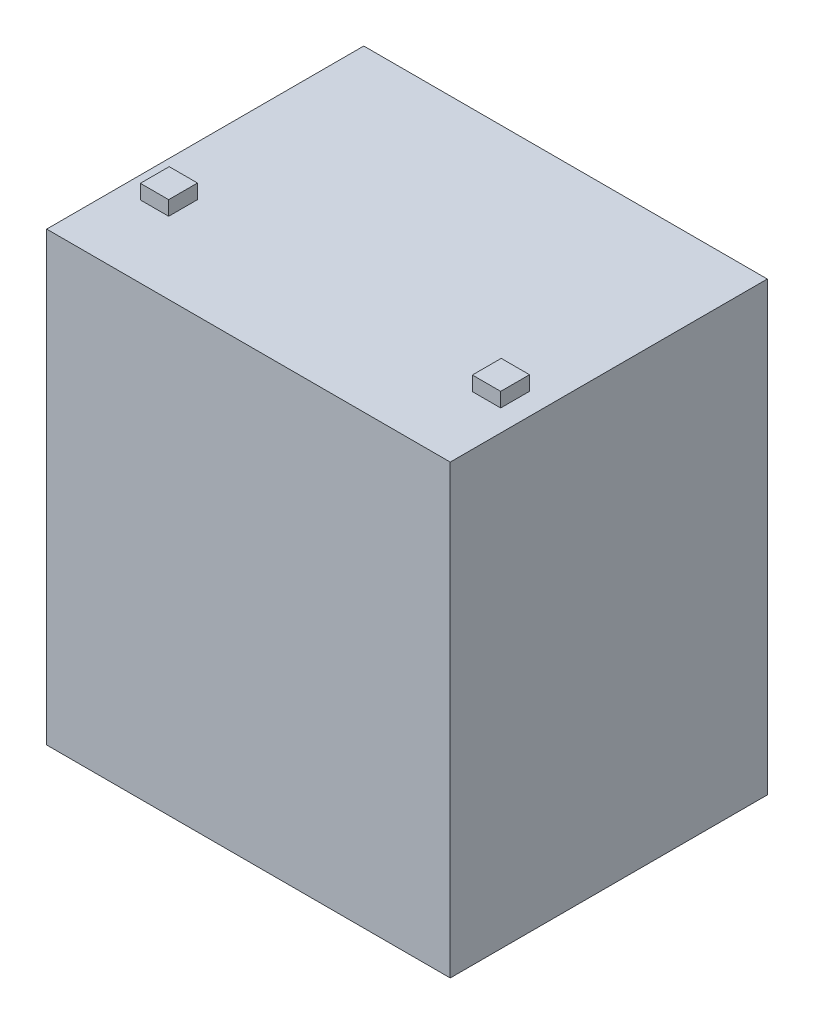
from build123d import *

# Parameters (mm, degrees)
SKETCH2_W           = 88.9
SKETCH2_H           = 98.425
BOSS_EXTRUDE1_DEPTH = 69.85
SKETCH3_W           = 6.235827492
SKETCH3_H           = 6.35
BOSS_EXTRUDE2_DEPTH = 3.175


with BuildPart() as part:
    # Sketch2 → Boss-Extrude1 (new body)
    with BuildSketch(Plane.XY):
        Rectangle(SKETCH2_W, SKETCH2_H)
    extrude(amount=-BOSS_EXTRUDE1_DEPTH)

    # Sketch3 → Boss-Extrude2 (add)
    with BuildSketch(Plane(origin=(0, 49.2125, 0), x_dir=(1, 0, 0), z_dir=(0, 1, 0))):
        with Locations((-36.569586254, 19.05)):
            Rectangle(SKETCH3_W, SKETCH3_H)
        with Locations((36.569586254, 19.05)):
            Rectangle(SKETCH3_W, SKETCH3_H)
    extrude(amount=BOSS_EXTRUDE2_DEPTH)


solid = part.part
